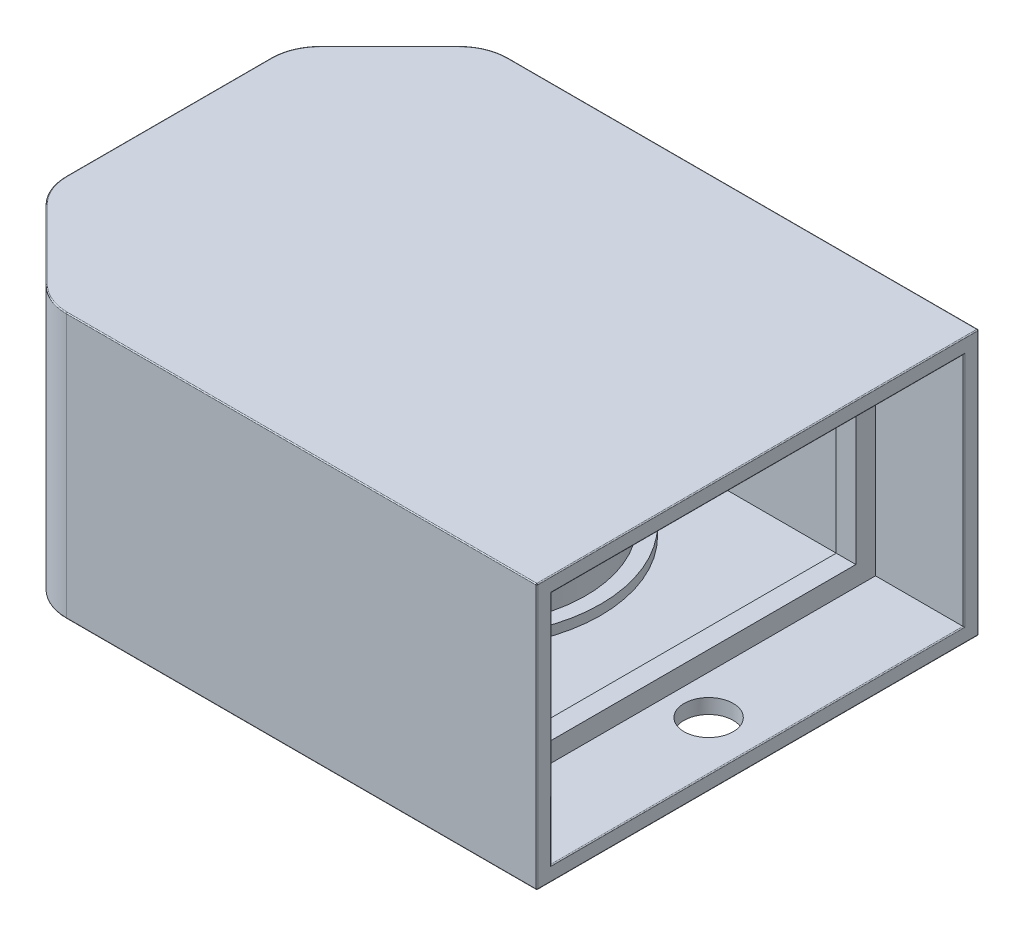
from build123d import *

# Parameters (mm, degrees)
SKETCH_1_W          = 60
SKETCH_1_H          = 45
EXTRUDE_1_DEPTH     = 13.5
CHAMFER_1_SIZE      = 10
FILLET_1_R          = 5
SHELL_1_T           = -1.5
FILLET_2_R          = 0.1
SKETCH_4_W          = 42
SKETCH_4_H          = 24
SKETCH_4_W_2        = 38
SKETCH_4_H_2        = 20
EXTRUDE_1_2_DEPTH   = 1
EXTRUDE_START       = 1
SKETCH_5_R          = 4
EXTRUDE_2_DEPTH     = 1
EXTRUDE_3_DEPTH     = 10
CUT_EXTRUDE_1_REACH = 47.349
SKETCH_7_R          = 2.5


with BuildPart() as part:
    # 草图1 → Extrude 1 (new, symmetric)
    with BuildSketch(Plane(origin=(0, 0, 0), x_dir=(1, 0, 0), z_dir=(0, 1, 0))):
        Rectangle(SKETCH_1_W, SKETCH_1_H)
    extrude(amount=EXTRUDE_1_DEPTH, both=True)

    # 倒角1
    chamfer_1_edges = [part.edges().sort_by_distance(p)[0] for p in [
        (-30, 0, 22.5),
        (-30, 0, -22.5),
    ]]
    chamfer(chamfer_1_edges, length=CHAMFER_1_SIZE)

    # 圆角1
    fillet_1_edges = [part.edges().sort_by_distance(p)[0] for p in [
        (-30, 0, 12.5),
        (-30, 0, -12.5),
        (-20, 0, -22.5),
        (-20, 0, 22.5),
    ]]
    fillet(fillet_1_edges, radius=FILLET_1_R)

    # 抽壳1
    shell_1_openings = [part.faces().sort_by_distance(p)[0] for p in [
        (30, 0, 0),
    ]]
    offset(amount=SHELL_1_T, openings=shell_1_openings, kind=Kind.INTERSECTION)

    # 圆角2
    fillet_2_edges = [part.edges().sort_by_distance(p)[0] for p in [
        (-25, 13.5, -17.5),
        (-30, 13.5, 0),
        (-25, 13.5, 17.5),
        (6.035533906, 13.5, 22.5),
        (-19.84234935, 13.5, 22.119397663),
        (-29.619397663, 13.5, 12.34234935),
        (-29.619397663, 13.5, -12.34234935),
        (-19.84234935, 13.5, -22.119397663),
        (-25, -13.5, -17.5),
        (-30, -13.5, 0),
        (6.035533906, -13.5, 22.5),
        (-25, -13.5, 17.5),
        (-19.84234935, -13.5, 22.119397663),
        (-29.619397663, -13.5, 12.34234935),
        (-29.619397663, -13.5, -12.34234935),
        (-19.84234935, -13.5, -22.119397663),
        (30, 13.5, 0),
        (6.035533906, -13.5, -22.5),
        (30, -12, 0),
        (30, 0, 21),
        (30, 0, -21),
        (30, 12, 0),
        (30, -13.5, 0),
        (6.035533906, 13.5, -22.5),
        (30, 0, 22.5),
        (30, 0, -22.5),
    ]]
    fillet(fillet_2_edges, radius=FILLET_2_R)

    # 草图3 → 旋转1 (revolve)
    with BuildSketch(Plane.XY, mode=Mode.PRIVATE) as revolve_1_sk:
        Polygon((0, 12), (4, 12), (4, 3.5), (14, 3.5), (14, 2.5), (12.5, 2.5), (12.5, -7.5), (14, -7.5), (14, -8.5), (4, -8.5), (4, -12), (0, -12), align=None)
    revolve(revolve_1_sk.sketch.rotate(Axis((0, 13.4, 0), (0, -1, 0)), 90), axis=Axis((0, 13.4, 0), (0, -1, 0)))

    # 草图4 → Extrude 1 2 (add, symmetric)
    with BuildSketch(Plane(origin=(20, 0, 0), x_dir=(0, 0, -1), z_dir=(1, 0, 0))):
        Rectangle(SKETCH_4_W, SKETCH_4_H)
        Rectangle(SKETCH_4_W_2, SKETCH_4_H_2, mode=Mode.SUBTRACT)
    extrude(amount=EXTRUDE_1_2_DEPTH, both=True)

    # 草图5 → 凸台-拉伸2 (add)
    with BuildSketch(Plane.XZ.offset(13.5).offset(EXTRUDE_START)):
        with Locations(Location((0, 0, 0), (0, 0, 90))):
            Circle(SKETCH_5_R)
    extrude(amount=-EXTRUDE_2_DEPTH)

    # 草图6 → 凸台-拉伸3 (add)
    with BuildSketch(Plane.XZ.offset(14.5)):
        Polygon((4, 0), (2, 3.464101615), (-2, 3.464101615), (-4, 0), (-2, -3.464101615), (2, -3.464101615), align=None)
    extrude(amount=EXTRUDE_3_DEPTH)

    # 草图7 → 切除-拉伸1 (cut, up to next)
    with BuildSketch(Plane(origin=(0, -12, 0), x_dir=(1, 0, 0), z_dir=(0, 1, 0)), mode=Mode.PRIVATE) as cut_extrude_1_sk1:
        with Locations(Location((25, 0, 0), (0, 0, 270))):
            Circle(SKETCH_7_R)
    cut_extrude_1_tool1 = extrude(cut_extrude_1_sk1.sketch, amount=-CUT_EXTRUDE_1_REACH, mode=Mode.PRIVATE) & part.part
    add(cut_extrude_1_tool1.solids().sort_by_distance((25, -12, 0))[0], mode=Mode.SUBTRACT)


solid = part.part
